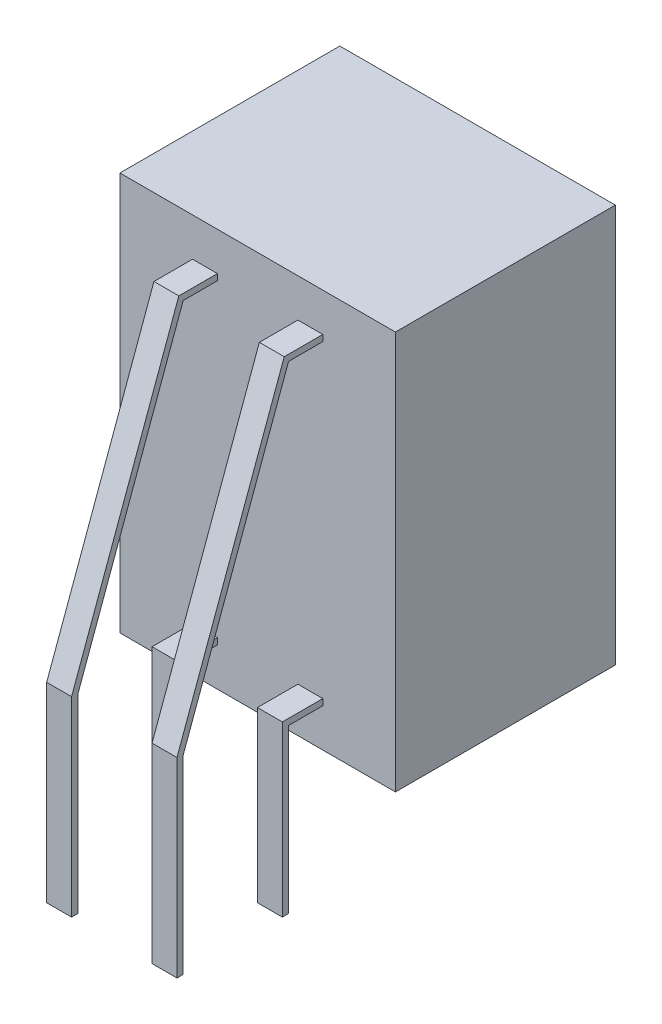
from build123d import *

# Parameters (mm, degrees)
SKETCH1_W             = 6.64
SKETCH1_H             = 5.3
BOSS_EXTRUDE1_DEPTH   = 9.6
SKETCH2_W             = 1.6
SKETCH2_H             = 3.6
CUT_EXTRUDE1_DEPTH    = 0.4
SKETCH3_W             = 1.4
SKETCH3_H             = 1.6
BOSS_EXTRUDE3_DEPTH   = 1.4
BOSS_EXTRUDE4_DEPTH   = 0.3
BOSS_EXTRUDE4_2_DEPTH = 0.3


with BuildPart() as part:
    # Sketch1 → Boss-Extrude1 (new body)
    with BuildSketch(Plane(origin=(0, 0, 0), x_dir=(1, 0, 0), z_dir=(0, 1, 0))):
        with Locations((0, -2.65)):
            Rectangle(SKETCH1_W, SKETCH1_H)
    extrude(amount=BOSS_EXTRUDE1_DEPTH)

    # Sketch2 → Cut-Extrude1 (cut)
    with BuildSketch(Plane(origin=(0, 0, 0), x_dir=(-1, 0, 0), z_dir=(0, 0, -1))):
        with Locations((-1.27, 4.8)):
            Rectangle(SKETCH2_W, SKETCH2_H)
        with Locations((1.27, 4.8)):
            Rectangle(SKETCH2_W, SKETCH2_H)
    extrude(amount=-CUT_EXTRUDE1_DEPTH, mode=Mode.SUBTRACT)

    # Sketch3 → Boss-Extrude3 (add)
    with BuildSketch(Plane(origin=(0, 0, 0.4), x_dir=(-1, 0, 0), z_dir=(0, 0, -1))):
        with Locations((-1.27, 3.9)):
            Rectangle(SKETCH3_W, SKETCH3_H)
        with Locations((1.27, 3.9)):
            Rectangle(SKETCH3_W, SKETCH3_H)
    extrude(amount=BOSS_EXTRUDE3_DEPTH)


with BuildPart() as body_2:
    # Sketch4 → Boss-Extrude4 (new, symmetric)
    with BuildSketch(Plane(origin=(1.27, 0, 0), x_dir=(0, 0, -1), z_dir=(1, 0, 0))):
        Polygon((-5.3, 8.675), (-6.229883482, 8.675), (-8.815, 1.60155126), (-8.815, -3), (-8.665, -3), (-8.665, 1.575), (-6.125, 8.525), (-5.3, 8.525), align=None)
    boss_extrude4 = extrude(amount=BOSS_EXTRUDE4_DEPTH, both=True)


with BuildPart() as body_3:
    # Sketch4 → Boss-Extrude4 2 (new, symmetric)
    with BuildSketch(Plane(origin=(1.27, 0, 0), x_dir=(0, 0, -1), z_dir=(1, 0, 0))):
        Polygon((-5.3, 0.925), (-6.125, 0.925), (-6.125, -3), (-6.275, -3), (-6.275, 1.075), (-5.3, 1.075), align=None)
    boss_extrude4_2 = extrude(amount=BOSS_EXTRUDE4_2_DEPTH, both=True)


with BuildPart() as part_1:
    add(part.part)

    # Mirror1: Boss-Extrude4, Boss-Extrude4 2 across plane
    add(boss_extrude4.mirror(Plane(origin=(0, 0, 0), x_dir=(0, 0, 1), z_dir=(1, 0, 0))))
    add(boss_extrude4_2.mirror(Plane(origin=(0, 0, 0), x_dir=(0, 0, 1), z_dir=(1, 0, 0))))


solid = Compound([body_2.part, body_3.part, part_1.part])
